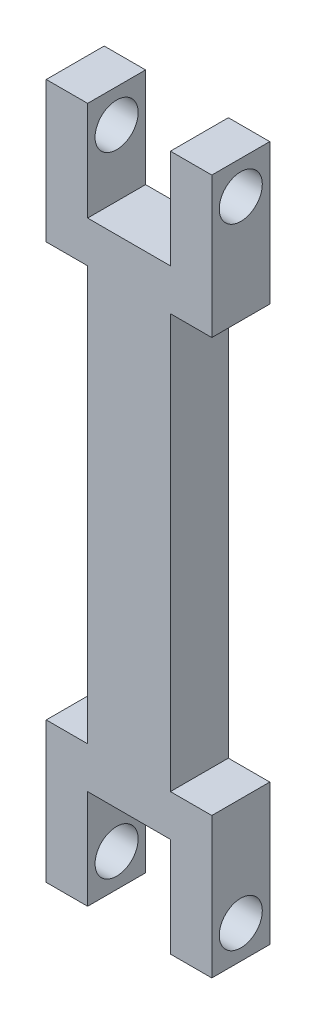
from build123d import *

# Parameters (mm, degrees)
SKETCH1_W           = 12.7
SKETCH1_H           = 8.89
BOSS_EXTRUDE1_DEPTH = 76.2
SKETCH2_W           = 8.89
SKETCH2_H           = 6.35
BOSS_EXTRUDE2_DEPTH = 6.35
SKETCH3_W           = 8.89
SKETCH3_H           = 6.35
BOSS_EXTRUDE3_DEPTH = 6.35
SKETCH4_W           = 6.35
SKETCH4_H           = 8.89
BOSS_EXTRUDE4_DEPTH = 15.24
SKETCH7_W           = 6.35
SKETCH7_H           = 8.89
BOSS_EXTRUDE5_DEPTH = 15.24
SKETCH8_R           = 3.302
CUT_EXTRUDE2_DEPTH  = 35.306
SKETCH6_R           = 3.302
CUT_EXTRUDE3_DEPTH  = 33.528


with BuildPart() as part:
    # Sketch1 → Boss-Extrude1 (new body)
    with BuildSketch(Plane(origin=(0, 0, 0), x_dir=(1, 0, 0), z_dir=(0, 1, 0))):
        with Locations((6.35, 4.445)):
            Rectangle(SKETCH1_W, SKETCH1_H)
    extrude(amount=BOSS_EXTRUDE1_DEPTH)

    # Sketch2 → Boss-Extrude2 (add)
    with BuildSketch(Plane(origin=(12.7, 0, 0), x_dir=(0, 0, -1), z_dir=(1, 0, 0))):
        with Locations((4.445, 3.175)):
            Rectangle(SKETCH2_W, SKETCH2_H)
        with Locations((4.445, 73.025)):
            Rectangle(SKETCH2_W, SKETCH2_H)
    extrude(amount=BOSS_EXTRUDE2_DEPTH)

    # Sketch3 → Boss-Extrude3 (add)
    with BuildSketch(Plane.ZY):
        with Locations((-4.445, 3.175)):
            Rectangle(SKETCH3_W, SKETCH3_H)
        with Locations((-4.445, 73.025)):
            Rectangle(SKETCH3_W, SKETCH3_H)
    extrude(amount=BOSS_EXTRUDE3_DEPTH)

    # Sketch4 → Boss-Extrude4 (add)
    with BuildSketch(Plane(origin=(0, 76.2, 0), x_dir=(1, 0, 0), z_dir=(0, 1, 0))):
        with Locations((-3.175, 4.445)):
            Rectangle(SKETCH4_W, SKETCH4_H)
        with Locations((15.875, 4.445)):
            Rectangle(SKETCH4_W, SKETCH4_H)
    extrude(amount=BOSS_EXTRUDE4_DEPTH)

    # Sketch7 → Boss-Extrude5 (add)
    with BuildSketch(Plane.XZ):
        with Locations((-3.175, -4.445)):
            Rectangle(SKETCH7_W, SKETCH7_H)
        with Locations((15.875, -4.445)):
            Rectangle(SKETCH7_W, SKETCH7_H)
    extrude(amount=BOSS_EXTRUDE5_DEPTH)

    # Sketch8 → Cut-Extrude2 (cut)
    with BuildSketch(Plane(origin=(19.05, 0, 0), x_dir=(0, 0, -1), z_dir=(1, 0, 0))):
        with Locations((4.445, -10.16)):
            Circle(SKETCH8_R)
    extrude(amount=-CUT_EXTRUDE2_DEPTH, mode=Mode.SUBTRACT)

    # Sketch6 → Cut-Extrude3 (cut)
    with BuildSketch(Plane(origin=(19.05, 0, 0), x_dir=(0, 0, -1), z_dir=(1, 0, 0))):
        with Locations((4.445, 86.36)):
            Circle(SKETCH6_R)
    extrude(amount=-CUT_EXTRUDE3_DEPTH, mode=Mode.SUBTRACT)


solid = part.part
